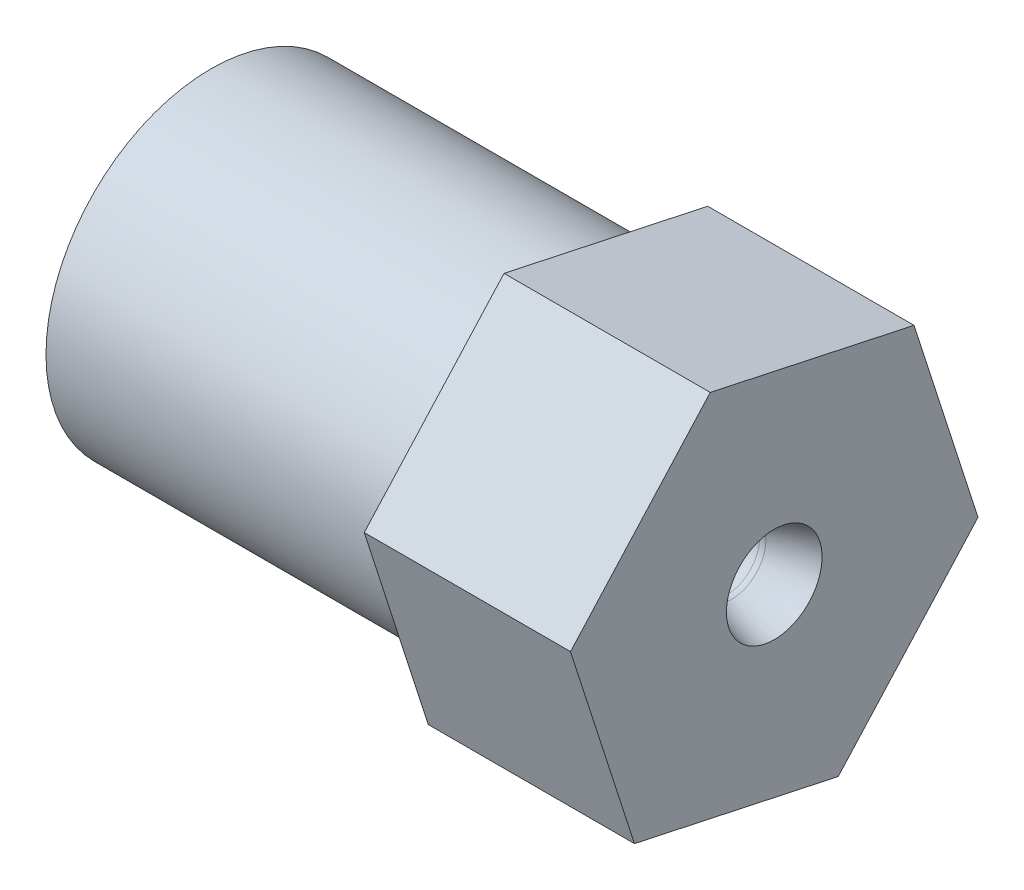
from build123d import *

# Parameters (mm, degrees)
SKETCH4_R           = 10.16
BOSS_EXTRUDE1_DEPTH = 12.7
FILLET1_R           = 0.635


with BuildPart() as part:
    # Sketch1 → Revolve1 (revolve)
    with BuildSketch(Plane.XY, mode=Mode.PRIVATE) as revolve1_sk:
        with BuildLine():
            Line((-2.155261469, 2.924738531), (-2.745586968, 3.51506403))
            ThreePointArc((-2.745586968, 3.51506403), (-3.775631101, 4.203317516), (-4.990650999, 4.445))
            Line((-4.990650999, 4.445), (-13.462, 4.445))
            Line((-13.462, 4.445), (-13.462, 4.699))
            ThreePointArc((-13.462, 4.699), (-13.499197439, 4.788802561), (-13.589, 4.826))
            Line((-13.589, 4.826), (-19.304, 4.826))
            ThreePointArc((-19.304, 4.826), (-19.753012806, 5.011987194), (-19.939, 5.461))
            Line((-19.939, 5.461), (-19.939, 6.8199))
            ThreePointArc((-19.939, 6.8199), (-19.976197439, 6.909702561), (-20.066, 6.9469))
            Line((-20.066, 6.9469), (-24.892, 6.9469))
            Line((-24.892, 6.9469), (-24.892, 7.8994))
            ThreePointArc((-24.892, 7.8994), (-24.929197439, 7.989202561), (-25.019, 8.0264))
            Line((-25.019, 8.0264), (-31.115, 8.0264))
            ThreePointArc((-31.115, 8.0264), (-31.564012806, 8.212387194), (-31.75, 8.6614))
            Line((-31.75, 8.6614), (-31.75, 10.16))
            Line((-31.75, 10.16), (-9.766473787, 10.16))
            Line((-9.766473787, 10.16), (2.933526213, 10.16))
            Line((2.933526213, 10.16), (2.933526213, 2.944647755))
            add(Edge.make_bspline(
                [(2.933526213, 2.944647755), (1.578373565, 2.631786114), (0.317586261, 2.096613655)],
                knots=[0, 0, 0, 1, 1, 1], degree=2))
            ThreePointArc((0.317586261, 2.096613655), (0.162046257, 2.0483172), (0, 2.032))
            ThreePointArc((0, 2.032), (-1.166419102, 2.264015185), (-2.155261469, 2.924738531))
        make_face()
    revolve(revolve1_sk.sketch.rotate(Axis((0, 0, 0), (1, 0, 0)), 90), axis=Axis((0, 0, 0), (1, 0, 0)))

    # Sketch4 → Boss-Extrude1 (add)
    with BuildSketch(Plane(origin=(2.933526213, 0, 0), x_dir=(0, 0, -1), z_dir=(1, 0, 0))):
        Polygon((3.940411868, -12.211607701), (12.545768424, -2.693307071), (8.605356556, 9.51830063), (-3.940411868, 12.211607701), (-12.545768424, 2.693307071), (-8.605356556, -9.51830063), align=None)
        with Locations(Location((0, 0, 0), (0, 0, 180))):
            Circle(SKETCH4_R, mode=Mode.SUBTRACT)
    extrude(amount=-BOSS_EXTRUDE1_DEPTH)

    # Fillet1
    fillet1_edges = [part.edges().sort_by_distance(p)[0] for p in [
        (-9.766473787, 0, -10.16),
    ]]
    fillet(fillet1_edges, radius=FILLET1_R)


solid = part.part
